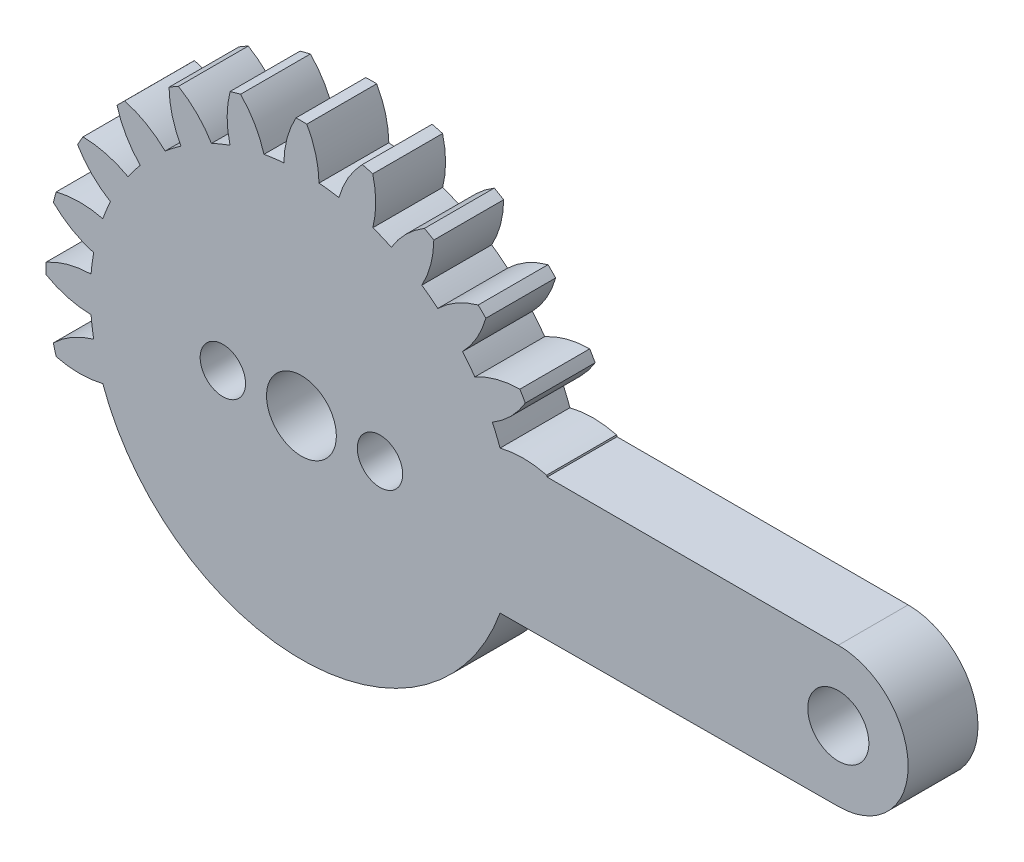
from build123d import *

# Parameters (mm, degrees)
SKETCH1_R           = 1.75
BOSS_EXTRUDE2_DEPTH = 4
SKETCH2_R           = 1.3
SKETCH2_R_2         = 2
CUT_EXTRUDE1_DEPTH  = 38.915688046
SCALE1_SCALE_X      = 1.5
SCALE1_SCALE_Y      = 1.5
SCALE1_SCALE_Z      = 1.5


with BuildPart() as part:
    # Sketch1 → Boss-Extrude2 (new body)
    with BuildSketch(Plane.XY):
        with BuildLine():
            ThreePointArc((30.768609945, -3.999956709), (34.749989177, 0.009304998), (30.75, 4))
            Line((30.75, 4), (14.072558403, 4))
            ThreePointArc((14.072558403, 4), (14.06038767, 4.04257326), (14.048088143, 4.085109489))
            ThreePointArc((14.048088143, 4.085109489), (12.712915648, 4.255390909), (11.377106712, 4.090176385))
            ThreePointArc((11.377106712, 4.090176385), (11.169703548, 4.626642697), (10.937020765, 5.152637848))
            ThreePointArc((10.937020765, 5.152637848), (11.998404632, 5.980373095), (12.82210701, 7.044889767))
            ThreePointArc((12.82210701, 7.044889767), (12.669951657, 7.315), (12.51210701, 7.581825517))
            ThreePointArc((12.51210701, 7.581825517), (11.17835734, 7.400736668), (9.930825655, 6.8954189))
            ThreePointArc((9.930825655, 6.8954189), (9.591641884, 7.359925677), (9.230750012, 7.807775241))
            ThreePointArc((9.230750012, 7.807775241), (10.041734454, 8.882012453), (10.561852666, 10.123446462))
            ThreePointArc((10.561852666, 10.123446462), (10.344972209, 10.344972209), (10.123446462, 10.561852666))
            ThreePointArc((10.123446462, 10.561852666), (8.882012453, 10.041734454), (7.807775241, 9.230750012))
            ThreePointArc((7.807775241, 9.230750012), (7.359925677, 9.591641884), (6.8954189, 9.930825655))
            ThreePointArc((6.8954189, 9.930825655), (7.400736668, 11.17835734), (7.581825517, 12.51210701))
            ThreePointArc((7.581825517, 12.51210701), (7.315, 12.669951657), (7.044889767, 12.82210701))
            ThreePointArc((7.044889767, 12.82210701), (5.980373095, 11.998404632), (5.152637848, 10.937020765))
            ThreePointArc((5.152637848, 10.937020765), (4.626642697, 11.169703548), (4.090176385, 11.377106712))
            ThreePointArc((4.090176385, 11.377106712), (4.255390909, 12.712915648), (4.085109489, 14.048088143))
            ThreePointArc((4.085109489, 14.048088143), (3.78652263, 14.131494839), (3.486235477, 14.208555951))
            ThreePointArc((3.486235477, 14.208555951), (2.671181194, 13.137403362), (2.1463567, 11.897951627))
            ThreePointArc((2.1463567, 11.897951627), (1.578061664, 11.986568374), (1.00619511, 12.048056748))
            ThreePointArc((1.00619511, 12.048056748), (0.820047291, 13.381109763), (0.31, 14.626715284))
            ThreePointArc((0.31, 14.626715284), (0, 14.63), (-0.31, 14.626715284))
            ThreePointArc((-0.31, 14.626715284), (-0.820047291, 13.381109763), (-1.00619511, 12.048056748))
            ThreePointArc((-1.00619511, 12.048056748), (-1.578061664, 11.986568374), (-2.1463567, 11.897951627))
            ThreePointArc((-2.1463567, 11.897951627), (-2.671181194, 13.137403362), (-3.486235477, 14.208555951))
            ThreePointArc((-3.486235477, 14.208555951), (-3.78652263, 14.131494839), (-4.085109489, 14.048088143))
            ThreePointArc((-4.085109489, 14.048088143), (-4.255390909, 12.712915648), (-4.090176385, 11.377106712))
            ThreePointArc((-4.090176385, 11.377106712), (-4.626642697, 11.169703548), (-5.152637848, 10.937020765))
            ThreePointArc((-5.152637848, 10.937020765), (-5.980373095, 11.998404632), (-7.044889767, 12.82210701))
            ThreePointArc((-7.044889767, 12.82210701), (-7.315, 12.669951657), (-7.581825517, 12.51210701))
            ThreePointArc((-7.581825517, 12.51210701), (-7.400736668, 11.17835734), (-6.8954189, 9.930825655))
            ThreePointArc((-6.8954189, 9.930825655), (-7.359925677, 9.591641884), (-7.807775241, 9.230750012))
            ThreePointArc((-7.807775241, 9.230750012), (-8.882012453, 10.041734454), (-10.123446462, 10.561852666))
            ThreePointArc((-10.123446462, 10.561852666), (-10.344972209, 10.344972209), (-10.561852666, 10.123446462))
            ThreePointArc((-10.561852666, 10.123446462), (-10.041734454, 8.882012453), (-9.230750012, 7.807775241))
            ThreePointArc((-9.230750012, 7.807775241), (-9.591641884, 7.359925677), (-9.930825655, 6.8954189))
            ThreePointArc((-9.930825655, 6.8954189), (-11.17835734, 7.400736668), (-12.51210701, 7.581825517))
            ThreePointArc((-12.51210701, 7.581825517), (-12.669951657, 7.315), (-12.82210701, 7.044889767))
            ThreePointArc((-12.82210701, 7.044889767), (-11.998404632, 5.980373095), (-10.937020765, 5.152637848))
            ThreePointArc((-10.937020765, 5.152637848), (-11.169703548, 4.626642697), (-11.377106712, 4.090176385))
            ThreePointArc((-11.377106712, 4.090176385), (-12.712915648, 4.255390909), (-14.048088143, 4.085109489))
            ThreePointArc((-14.048088143, 4.085109489), (-14.131494839, 3.78652263), (-14.208555951, 3.486235477))
            ThreePointArc((-14.208555951, 3.486235477), (-13.137403362, 2.671181194), (-11.897951627, 2.1463567))
            ThreePointArc((-11.897951627, 2.1463567), (-11.986568374, 1.578061664), (-12.048056748, 1.00619511))
            ThreePointArc((-12.048056748, 1.00619511), (-13.381109763, 0.820047291), (-14.626715284, 0.31))
            ThreePointArc((-14.626715284, 0.31), (-14.63, 0), (-14.626715284, -0.31))
            ThreePointArc((-14.626715284, -0.31), (-13.381109763, -0.820047291), (-12.048056748, -1.00619511))
            ThreePointArc((-12.048056748, -1.00619511), (-11.986568374, -1.578061664), (-11.897951627, -2.1463567))
            ThreePointArc((-11.897951627, -2.1463567), (-13.137403362, -2.671181194), (-14.208555951, -3.486235477))
            ThreePointArc((-14.208555951, -3.486235477), (-14.131494839, -3.78652263), (-14.048088143, -4.085109489))
            ThreePointArc((-14.048088143, -4.085109489), (-12.712915648, -4.255390909), (-11.377106712, -4.090176385))
            ThreePointArc((-11.377106712, -4.090176385), (0, -12.09), (11.377106712, -4.090176385))
            Line((11.377106712, -4.090176385), (30.768609945, -3.999956709))
        make_face()
        Circle(SKETCH1_R, mode=Mode.SUBTRACT)
        with Locations((30.75, 0)):
            Circle(SKETCH1_R, mode=Mode.SUBTRACT)
    extrude(amount=BOSS_EXTRUDE2_DEPTH)

    # Sketch2 → Cut-Extrude1 (cut, through all)
    with BuildSketch(Plane.XY.offset(4)):
        with Locations((4.5, 0)):
            Circle(SKETCH2_R)
        with Locations((-4.5, 0)):
            Circle(SKETCH2_R)
        Circle(SKETCH2_R_2)
    extrude(amount=-CUT_EXTRUDE1_DEPTH, mode=Mode.SUBTRACT)


with BuildPart() as part_1:
    # Scale1: scaled about (5.541380876, 0.56137033, 2)
    add(part.part.scale((SCALE1_SCALE_X, SCALE1_SCALE_Y, SCALE1_SCALE_Z), about=(5.541380876, 0.56137033, 2)))


solid = part_1.part
